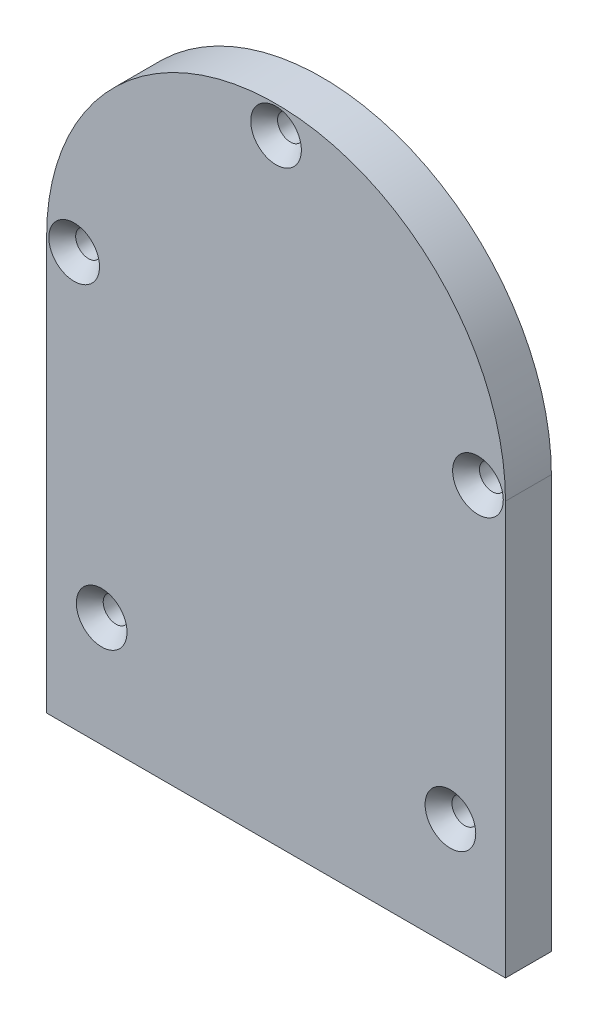
from build123d import *

# Parameters (mm, degrees)
BOSS_EXTRUDE1_DEPTH                               = 3.175
CSK_FOR_0_FLAT_HEAD_SOCKET_CAP_SCREW1_D           = 1.778
CSK_FOR_0_FLAT_HEAD_SOCKET_CAP_SCREW1_CSINK_D     = 3.5052
CSK_FOR_0_FLAT_HEAD_SOCKET_CAP_SCREW1_CSINK_ANGLE = 82


with BuildPart() as part:
    # Sketch1 → Boss-Extrude1 (new body)
    with BuildSketch(Plane.XY):
        with BuildLine():
            Line((-15.875, 0), (-15.875, -28.575))
            Line((-15.875, -28.575), (15.875, -28.575))
            Line((15.875, -28.575), (15.875, 0))
            ThreePointArc((15.875, 0), (0, 15.875), (-15.875, 0))
        make_face()
    extrude(amount=BOSS_EXTRUDE1_DEPTH)

    # CSK for #0 Flat Head Socket Cap Screw1 (through all)
    with Locations(Plane.XY.offset(3.175)):
        with Locations((0, 13.97), (-13.97, 0), (13.97, 0), (-12.065, -20.955), (12.065, -20.955)):
            CounterSinkHole(CSK_FOR_0_FLAT_HEAD_SOCKET_CAP_SCREW1_D / 2, CSK_FOR_0_FLAT_HEAD_SOCKET_CAP_SCREW1_CSINK_D / 2, counter_sink_angle=CSK_FOR_0_FLAT_HEAD_SOCKET_CAP_SCREW1_CSINK_ANGLE)


solid = part.part
